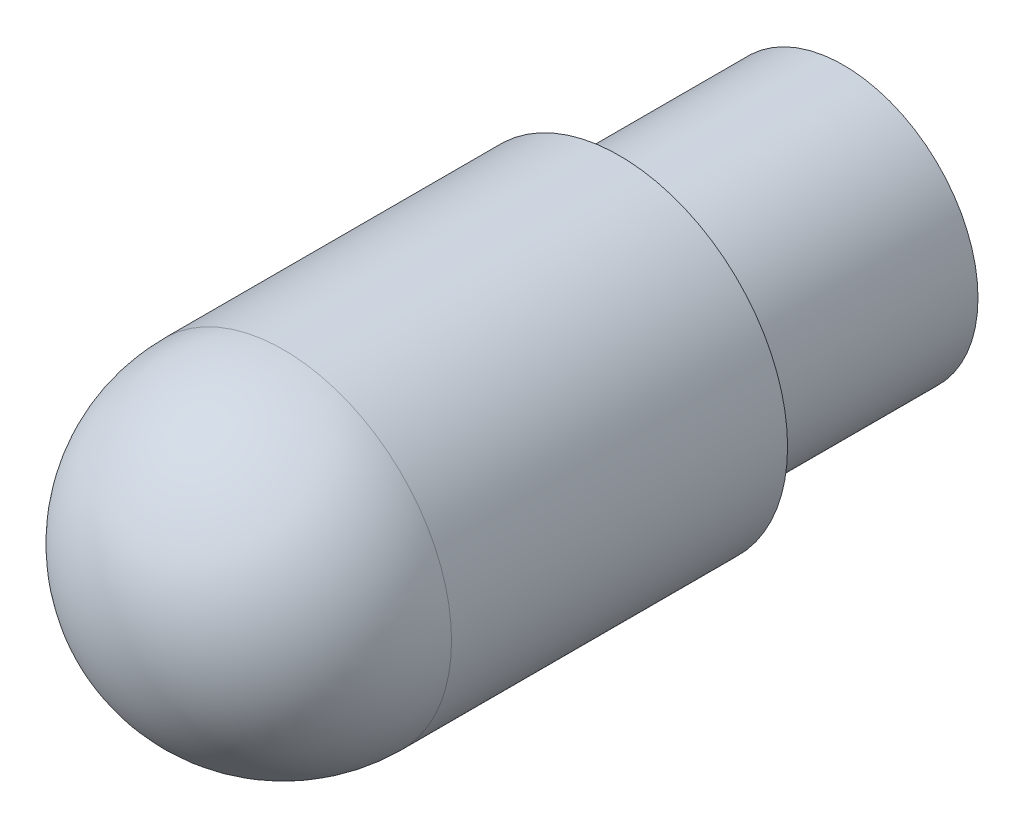
from build123d import *


with BuildPart() as part:
    # Sketch1 → Revolve3 (revolve)
    with BuildSketch(Plane(origin=(0, 0, 0), x_dir=(1, 0, 0), z_dir=(0, 1, 0))):
        with BuildLine():
            Line((-7.5, 0), (-7.5, 15))
            Line((-7.5, 15), (-6, 15))
            Line((-6, 15), (-6, 25))
            Line((-6, 25), (0, 25))
            Line((0, 25), (0, 15))
            Line((0, 15), (0, -7.5))
            ThreePointArc((0, -7.5), (-5.303300859, -5.303300859), (-7.5, 0))
        make_face()
    revolve(axis=Axis((0, 0, -15), (0, 0, 1)))


solid = part.part
